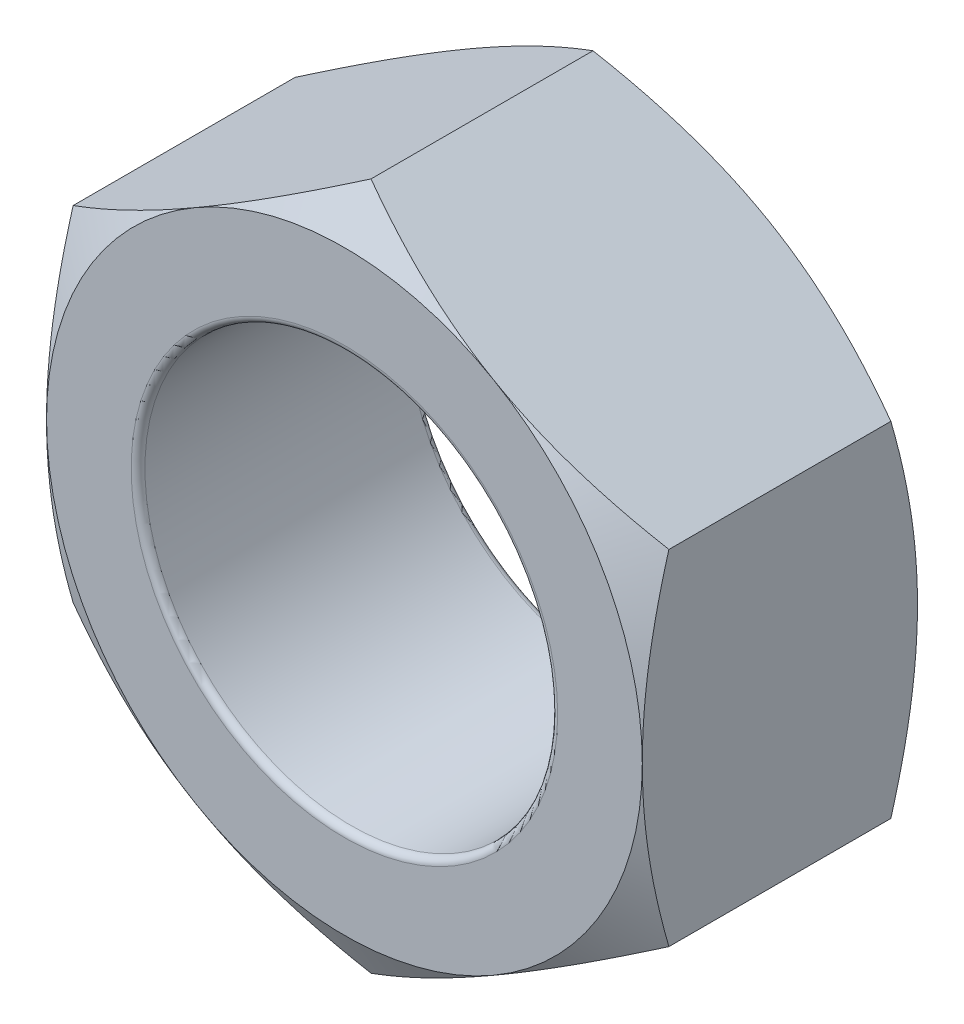
from build123d import *

# Parameters (mm, degrees)
SKETCH1_R           = 1.5
BOSS_EXTRUDE1_DEPTH = 2
SKETCH7_OUTSIDE_W   = 14.64
SKETCH7_OUTSIDE_H   = 15.31
SKETCH7_OUTSIDE_R   = 2.165063509
CUT_EXTRUDE1_DEPTH  = 2
CUT_EXTRUDE1_DRAFT  = -60
SKETCH9_OUTSIDE_W   = 14.64
SKETCH9_OUTSIDE_H   = 15.31
SKETCH9_OUTSIDE_R   = 2.165063509
CUT_EXTRUDE2_DEPTH  = 2
CUT_EXTRUDE2_DRAFT  = -60
FILLET1_R           = 0.05


with BuildPart() as part:
    # Sketch1 → Boss-Extrude1 (new body)
    with BuildSketch(Plane.XY):
        Polygon((0, 2.5), (-2.165063509, 1.25), (-2.165063509, -1.25), (0, -2.5), (2.165063509, -1.25), (2.165063509, 1.25), align=None)
        Circle(SKETCH1_R, mode=Mode.SUBTRACT)
    extrude(amount=BOSS_EXTRUDE1_DEPTH)


with BuildPart() as cut_extrude1_tool:
    # Sketch7 outside → Cut-Extrude1 (with draft: the straight prism first)
    with BuildSketch(Plane.XY.offset(2)):
        Rectangle(SKETCH7_OUTSIDE_W, SKETCH7_OUTSIDE_H)
        Circle(SKETCH7_OUTSIDE_R, mode=Mode.SUBTRACT)
    extrude(amount=-CUT_EXTRUDE1_DEPTH)
    # Cut-Extrude1: the draft: its side faces are tilted about the plane it starts from
    cut_extrude1_sides = [cut_extrude1_tool.faces().sort_by_distance(p)[0] for p in [
        (0, -7.655, 1),
        (7.32, 0, 1),
        (0, 7.655, 1),
        (-7.32, 0, 1),
        (-2.165063509, 0, 1),
    ]]
    draft(cut_extrude1_sides, Plane.XY.offset(2), CUT_EXTRUDE1_DRAFT)


with BuildPart() as part_1:
    add(part.part)

    # Cut-Extrude1: cut by cut_extrude1_tool
    add(cut_extrude1_tool.part, mode=Mode.SUBTRACT)


with BuildPart() as cut_extrude2_tool:
    # Sketch9 outside → Cut-Extrude2 (with draft: the straight prism first)
    with BuildSketch(Plane(origin=(0, 0, 0), x_dir=(-1, 0, 0), z_dir=(0, 0, -1))):
        Rectangle(SKETCH9_OUTSIDE_W, SKETCH9_OUTSIDE_H)
        Circle(SKETCH9_OUTSIDE_R, mode=Mode.SUBTRACT)
    extrude(amount=-CUT_EXTRUDE2_DEPTH)
    # Cut-Extrude2: the draft: its side faces are tilted about the plane it starts from
    cut_extrude2_sides = [cut_extrude2_tool.faces().sort_by_distance(p)[0] for p in [
        (0, -7.655, 1),
        (-7.32, 0, 1),
        (0, 7.655, 1),
        (7.32, 0, 1),
        (2.165063509, 0, 1),
    ]]
    draft(cut_extrude2_sides, Plane(origin=(0, 0, 0), x_dir=(-1, 0, 0), z_dir=(0, 0, -1)), CUT_EXTRUDE2_DRAFT)


with BuildPart() as part_2:
    add(part_1.part)

    # Cut-Extrude2: cut by cut_extrude2_tool
    add(cut_extrude2_tool.part, mode=Mode.SUBTRACT)

    # Fillet1
    fillet1_edges = [part_2.edges().sort_by_distance(p)[0] for p in [
        (-1.5, 0, 0),
        (-1.5, 0, 2),
    ]]
    fillet(fillet1_edges, radius=FILLET1_R)


solid = part_2.part
